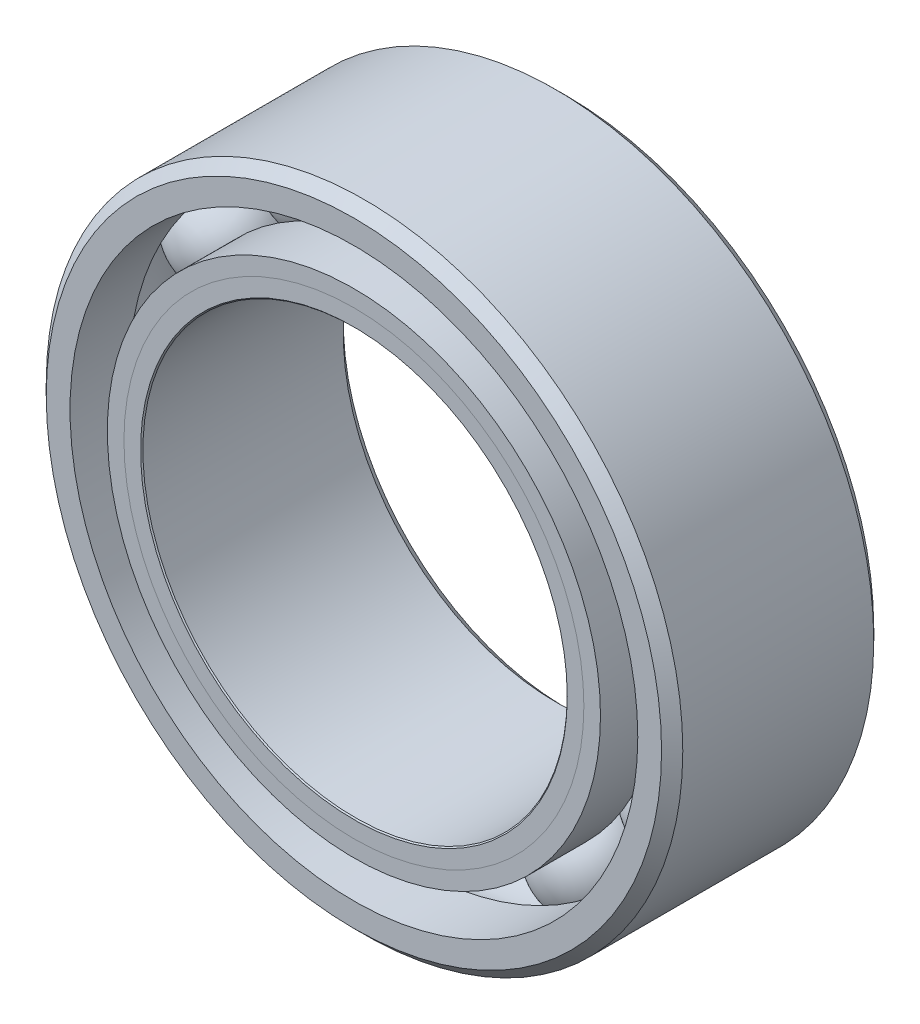
from build123d import *

# Parameters (mm, degrees)
CIRPATTERN1_COUNT = 12


with BuildPart() as part:
    # Sketch1 → Revolve1 (revolve)
    with BuildSketch(Plane(origin=(0, 0, 0), x_dir=(0, 0, -1), z_dir=(1, 0, 0)), mode=Mode.PRIVATE) as revolve1_sk:
        with BuildLine():
            Line((1.42875, 4.7625), (-1.42875, 4.7625))
            Line((-1.42875, 4.7625), (-1.5875, 4.60375))
            Line((-1.5875, 4.60375), (-1.5875, 4.247870879))
            Line((-1.5875, 4.247870879), (-0.705555556, 4.247870879))
            ThreePointArc((-0.705555556, 4.247870879), (0, 4.727510244), (0.705555556, 4.247870879))
            Line((0.705555556, 4.247870879), (1.5875, 4.247870879))
            Line((1.5875, 4.247870879), (1.5875, 4.60375))
            Line((1.5875, 4.60375), (1.42875, 4.7625))
        make_face()
    revolve(revolve1_sk.sketch.rotate(Axis((0, 0, 1.5875), (0, 0, -1)), 90), axis=Axis((0, 0, 1.5875), (0, 0, -1)))


with BuildPart() as body_2:
    # Sketch2 → Revolve2 (revolve)
    with BuildSketch(Plane(origin=(0, 0, 0), x_dir=(0, 0, -1), z_dir=(1, 0, 0)), mode=Mode.PRIVATE) as revolve2_sk:
        with BuildLine():
            Line((-1.5875, 3.689629121), (-0.705555556, 3.689629121))
            ThreePointArc((-0.705555556, 3.689629121), (-0.426574308, 3.341253811), (0, 3.209989756))
            Line((0, 3.209989756), (0, 3.192494878))
            Line((0, 3.192494878), (-1.338932879, 3.192494878))
            Line((-1.338932879, 3.192494878), (-1.5875, 3.441062))
            Line((-1.5875, 3.441062), (-1.5875, 3.689629121))
        make_face()
    revolve(revolve2_sk.sketch.rotate(Axis((0, 0, 1.5875), (0, 0, -1)), 90), axis=Axis((0, 0, 1.5875), (0, 0, -1)))


with BuildPart() as body_3:
    # Sketch3 → Revolve3 (revolve)
    with BuildSketch(Plane(origin=(0, 0, 0), x_dir=(0, 0, -1), z_dir=(1, 0, 0)), mode=Mode.PRIVATE) as revolve3_sk:
        with BuildLine():
            Line((-1.5875, 3.441062), (-1.338932879, 3.192494878))
            Line((-1.338932879, 3.192494878), (0, 3.192494878))
            Line((0, 3.192494878), (0, 3.209989756))
            ThreePointArc((0, 3.209989756), (0.426574308, 3.341253811), (0.705555556, 3.689629121))
            Line((0.705555556, 3.689629121), (1.5875, 3.689629121))
            Line((1.5875, 3.689629121), (1.5875, 3.33375))
            Line((1.5875, 3.33375), (1.42875, 3.175))
            Line((1.42875, 3.175), (-1.570005122, 3.175))
            Line((-1.570005122, 3.175), (-1.5875, 3.192494878))
            Line((-1.5875, 3.192494878), (-1.5875, 3.441062))
        make_face()
    revolve(revolve3_sk.sketch.rotate(Axis((0, 0, 1.5875), (0, 0, -1)), 90), axis=Axis((0, 0, 1.5875), (0, 0, -1)))


with BuildPart() as body_4:
    # Sketch4 → Revolve4 (revolve)
    with BuildSketch(Plane(origin=(0, 0, 0), x_dir=(0, 0, -1), z_dir=(1, 0, 0))):
        with BuildLine():
            Line((-0.758760244, 3.96875), (0.758760244, 3.96875))
            ThreePointArc((0.758760244, 3.96875), (0, 4.727510244), (-0.758760244, 3.96875))
        make_face()
    revolve(axis=Axis((0, 3.96875, 0.758760244), (0, 0, -1)))


with BuildPart() as cirpattern1_1:
    # CirPattern1: pattern copy
    add(body_4.part.rotate(Axis((0, 0, 0), (0, 0, 1)), 1 * 360 / CIRPATTERN1_COUNT))


with BuildPart() as cirpattern1_2:
    # CirPattern1: pattern copy
    add(body_4.part.rotate(Axis((0, 0, 0), (0, 0, 1)), 2 * 360 / CIRPATTERN1_COUNT))


with BuildPart() as cirpattern1_3:
    # CirPattern1: pattern copy
    add(body_4.part.rotate(Axis((0, 0, 0), (0, 0, 1)), 3 * 360 / CIRPATTERN1_COUNT))


with BuildPart() as cirpattern1_4:
    # CirPattern1: pattern copy
    add(body_4.part.rotate(Axis((0, 0, 0), (0, 0, 1)), 4 * 360 / CIRPATTERN1_COUNT))


with BuildPart() as cirpattern1_5:
    # CirPattern1: pattern copy
    add(body_4.part.rotate(Axis((0, 0, 0), (0, 0, 1)), 5 * 360 / CIRPATTERN1_COUNT))


with BuildPart() as cirpattern1_6:
    # CirPattern1: pattern copy
    add(body_4.part.rotate(Axis((0, 0, 0), (0, 0, 1)), 6 * 360 / CIRPATTERN1_COUNT))


with BuildPart() as cirpattern1_7:
    # CirPattern1: pattern copy
    add(body_4.part.rotate(Axis((0, 0, 0), (0, 0, 1)), 7 * 360 / CIRPATTERN1_COUNT))


with BuildPart() as cirpattern1_8:
    # CirPattern1: pattern copy
    add(body_4.part.rotate(Axis((0, 0, 0), (0, 0, 1)), 8 * 360 / CIRPATTERN1_COUNT))


with BuildPart() as cirpattern1_9:
    # CirPattern1: pattern copy
    add(body_4.part.rotate(Axis((0, 0, 0), (0, 0, 1)), 9 * 360 / CIRPATTERN1_COUNT))


with BuildPart() as cirpattern1_10:
    # CirPattern1: pattern copy
    add(body_4.part.rotate(Axis((0, 0, 0), (0, 0, 1)), 10 * 360 / CIRPATTERN1_COUNT))


with BuildPart() as cirpattern1_11:
    # CirPattern1: pattern copy
    add(body_4.part.rotate(Axis((0, 0, 0), (0, 0, 1)), 11 * 360 / CIRPATTERN1_COUNT))


solid = Compound([part.part, body_2.part, body_3.part, body_4.part, cirpattern1_1.part, cirpattern1_2.part, cirpattern1_3.part, cirpattern1_4.part, cirpattern1_5.part, cirpattern1_6.part, cirpattern1_7.part, cirpattern1_8.part, cirpattern1_9.part, cirpattern1_10.part, cirpattern1_11.part])
